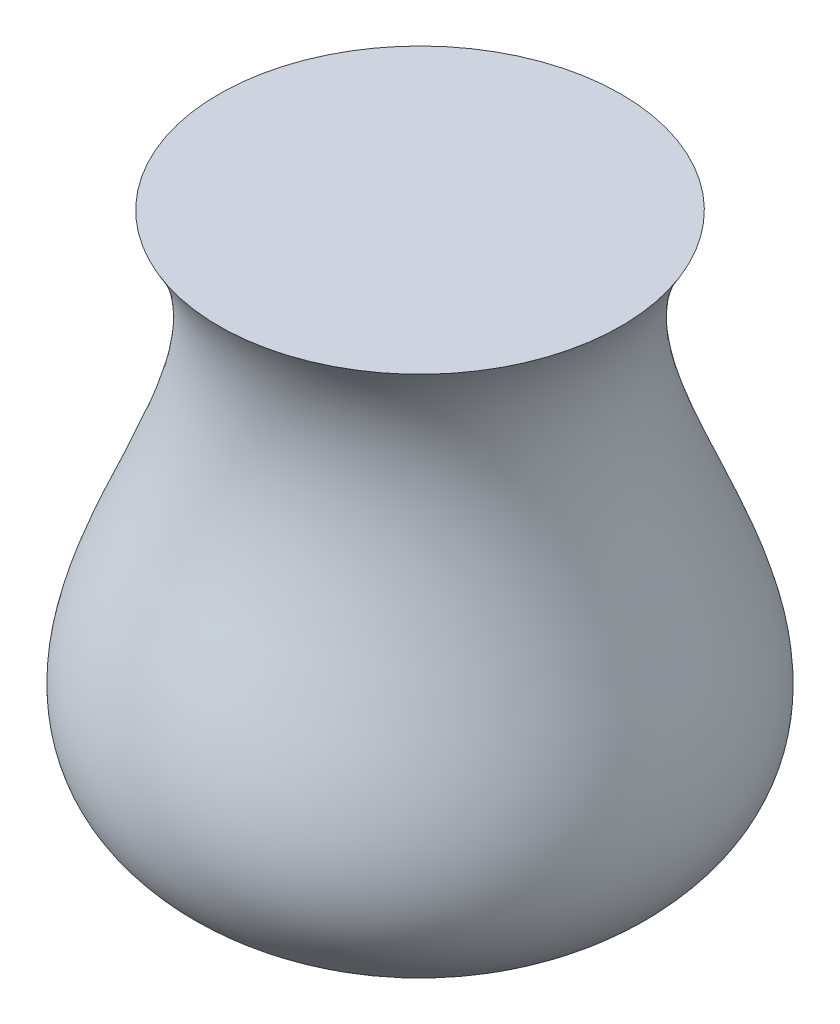
from build123d import *


with BuildPart() as part:
    # Çizim1 → Döndür1 (revolve)
    with BuildSketch(Plane.XY):
        with BuildLine():
            Line((1.000000225, 0.915643792), (66.422574233, 0.915643792))
            add(Edge.make_bspline(
                [(66.422574233, 0.915643792), (168.682792451, 44.417061322), (90.848126079, 140.156944838), (78.557032477, 238.154218937), (96.700291764, 266.365893382)],
                knots=[0, 0, 0, 0, 0.62678039, 0.901320887, 0.901320887, 0.901320887, 0.901320887], degree=3))
            Line((96.700291764, 266.365893382), (1.000000225, 266.365893382))
            Line((1.000000225, 266.365893382), (1.000000225, 0.915643792))
        make_face()
    revolve(axis=Axis((1.000000225, 0.915643792, 0), (0, 1, 0)))


solid = part.part
